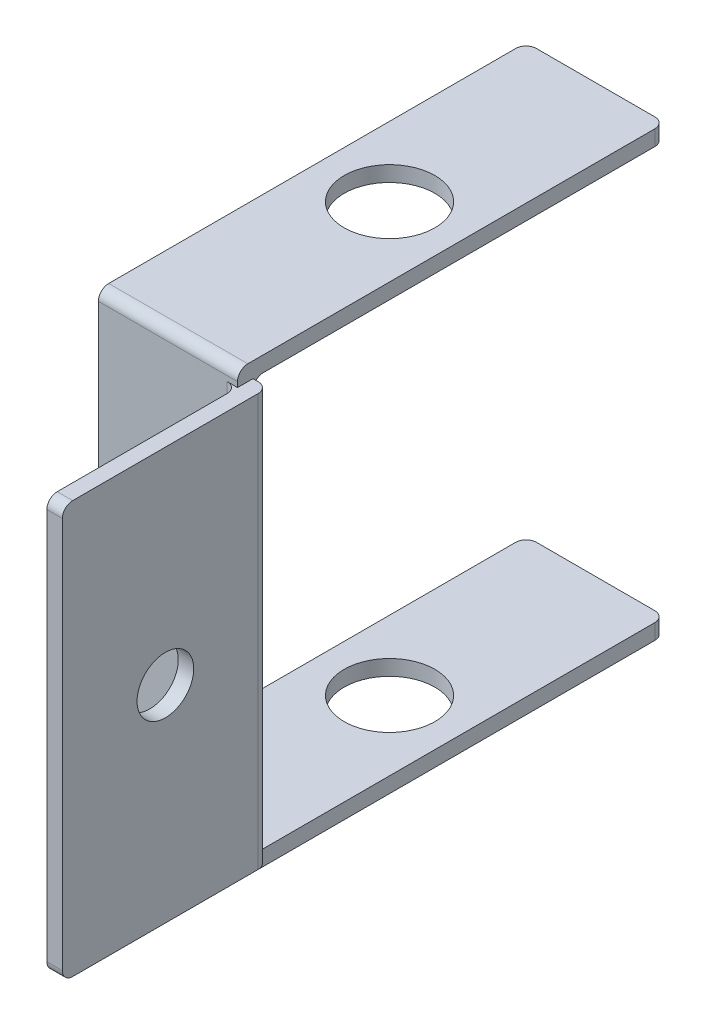
from build123d import *

# Parameters (mm, degrees)
SKETCH_1_W          = 13.5
SKETCH_1_H          = 40
EXTRUDE_1_DEPTH     = 1.5
SKETCH_1_3_W        = 1.5
SKETCH_1_3_H        = 40
EXTRUDE_2_DEPTH     = 20
SKETCH_2_W          = 13.5
SKETCH_2_H          = 1.5
EXTRUDE_3_DEPTH     = 41.5
SKETCH_3_R          = 2.75
CUT_EXTRUDE_1_DEPTH = 2
FILLET_1_R          = 1
CUT_EXTRUDE_2_DEPTH = 10
CUT_EXTRUDE_3_DEPTH = 60


with BuildPart() as part:
    # 草图1 → 凸台-拉伸1 (new body)
    with BuildSketch(Plane.XY):
        with Locations((6.75, -20)):
            Rectangle(SKETCH_1_W, SKETCH_1_H)
    extrude(amount=EXTRUDE_1_DEPTH)

    # 草图1<3> → 凸台-拉伸2 (add)
    with BuildSketch(Plane.XY):
        with Locations((14.25, -20)):
            Rectangle(SKETCH_1_3_W, SKETCH_1_3_H)
    extrude(amount=EXTRUDE_2_DEPTH)

    # 草图2 → 凸台-拉伸3 (add)
    with BuildSketch(Plane.XY.offset(1.5)):
        with Locations((6.75, 0.75)):
            Rectangle(SKETCH_2_W, SKETCH_2_H)
        with Locations((6.75, -40.75)):
            Rectangle(SKETCH_2_W, SKETCH_2_H)
    extrude(amount=-EXTRUDE_3_DEPTH)

    # 草图3 → 切除-拉伸1 (cut)
    with BuildSketch(Plane.ZY.offset(-13.5)):
        with Locations((10, -20)):
            Circle(SKETCH_3_R)
    extrude(amount=-CUT_EXTRUDE_1_DEPTH, mode=Mode.SUBTRACT)

    # 圆角1
    fillet_1_edges = [part.edges().sort_by_distance(p)[0] for p in [
        (14.25, 0, 20),
        (14.25, -40, 20),
        (13.5, -20, 1.5),
        (6.75, 0, 0),
        (6.75, 1.5, 1.5),
        (6.75, -40, 0),
        (15, -20, 0),
        (6.75, -41.5, 1.5),
        (13.5, 0.75, -40),
        (13.5, -40.75, -40),
        (0, -40.75, -40),
        (0, 0.75, -40),
    ]]
    fillet(fillet_1_edges, radius=FILLET_1_R)

    # 草图10 → 切除-拉伸2 (cut)
    with BuildSketch(Plane.XY.offset(1.5)):
        with BuildLine():
            ThreePointArc((1.85, -20), (6.25, -24.4), (10.65, -20))
            ThreePointArc((10.65, -20), (6.25, -15.6), (1.85, -20))
        make_face()
    extrude(amount=-CUT_EXTRUDE_2_DEPTH, mode=Mode.SUBTRACT)

    # 草图5 → 切除-拉伸3 (cut)
    with BuildSketch(Plane.XZ.offset(41.5)):
        with BuildLine():
            ThreePointArc((6.75, -24.4), (9.861269837, -23.111269837), (11.15, -20))
            ThreePointArc((11.15, -20), (3.638730163, -16.888730163), (6.75, -24.4))
        make_face()
    extrude(amount=-CUT_EXTRUDE_3_DEPTH, mode=Mode.SUBTRACT)


solid = part.part
